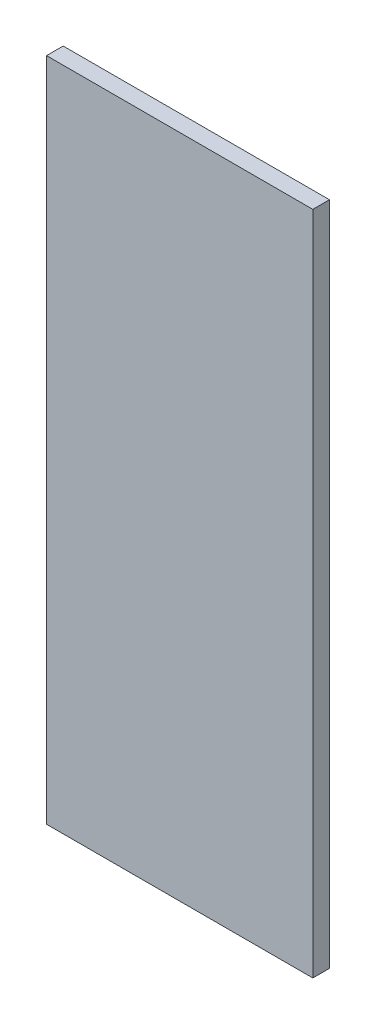
from build123d import *

# Parameters (mm, degrees)
SKETCH1_W           = 203.2
SKETCH1_H           = 508
BOSS_EXTRUDE1_DEPTH = 12.7


with BuildPart() as part:
    # Sketch1 → Boss-Extrude1 (new body)
    with BuildSketch(Plane.XY):
        with Locations((101.6, -254)):
            Rectangle(SKETCH1_W, SKETCH1_H)
    extrude(amount=BOSS_EXTRUDE1_DEPTH)


solid = part.part
